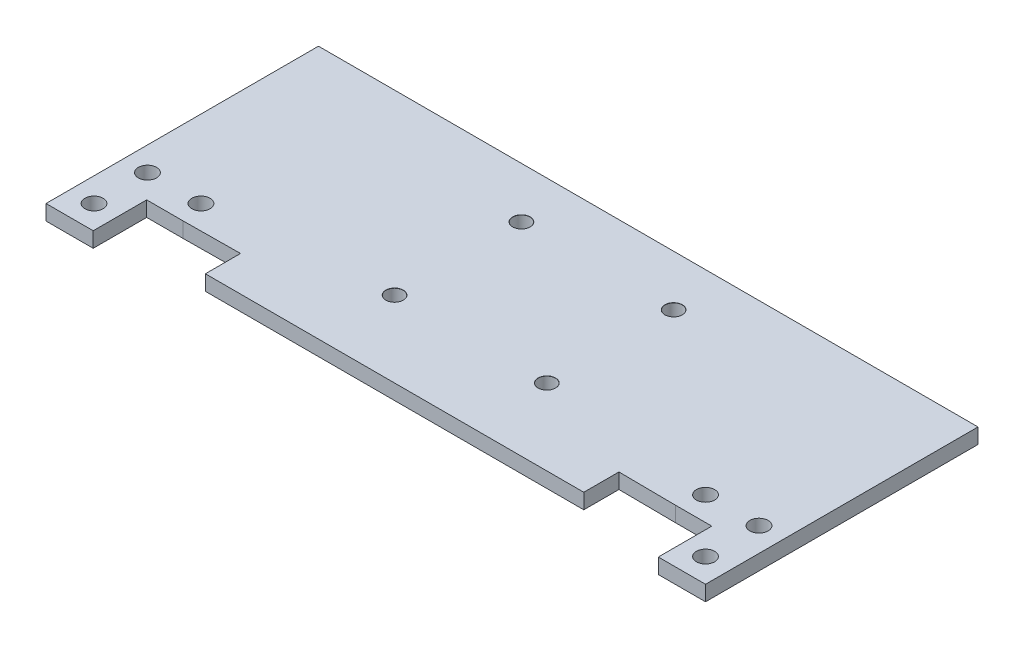
from build123d import *

# Parameters (mm, degrees)
SKETCH1_W                      = 50
SKETCH1_H                      = 3
BOSS_EXTRUDE1_DEPTH            = 130
M3_CLEARANCE_HOLE2_D           = 3.4
M3_CLEARANCE_HOLE2_CSINK_D     = 3.45
M3_CLEARANCE_HOLE2_CSINK_ANGLE = 90
SKETCH7_W                      = 21.804410209
SKETCH7_H                      = 3.710121499
BOSS_EXTRUDE2_DEPTH            = 3
CUT_EXTRUDE1_DEPTH             = 141.690312744
M3_CLEARANCE_HOLE3_D           = 3.6


with BuildPart() as part:
    # Sketch1 → Boss-Extrude1 (new body)
    with BuildSketch(Plane(origin=(0, 0, 0), x_dir=(0, 0, -1), z_dir=(1, 0, 0))):
        with Locations((28.71, 1.5)):
            Rectangle(SKETCH1_W, SKETCH1_H)
    extrude(amount=BOSS_EXTRUDE1_DEPTH)

    # M3 Clearance Hole2 (through all)
    with Locations(Plane(origin=(0, 3, 0), x_dir=(1, 0, 0), z_dir=(0, 1, 0))):
        with Locations((80, 18.71), (50, 43.71), (80, 43.71), (50, 18.71)):
            CounterSinkHole(M3_CLEARANCE_HOLE2_D / 2, M3_CLEARANCE_HOLE2_CSINK_D / 2, counter_sink_angle=M3_CLEARANCE_HOLE2_CSINK_ANGLE)

    # Sketch7 → Boss-Extrude2 (add)
    with BuildSketch(Plane.XZ):
        with Locations((119.097794896, -1.854939251)):
            Rectangle(SKETCH7_W, SKETCH7_H)
        with Locations((10.902205105, -1.854939251)):
            Rectangle(SKETCH7_W, SKETCH7_H)
    extrude(amount=-BOSS_EXTRUDE2_DEPTH)

    # Sketch9 → Cut-Extrude1 (cut, through all)
    # profile 1 of 2: a face of its own
    with BuildSketch(Plane(origin=(0, 3, 0), x_dir=(1, 0, 0), z_dir=(0, 1, 0))):
        Polygon((102.295589791, 0.840390735), (102.295589791, 10.639411436), (113.496480192, 10.53967858), (120.695589791, 10.53967858), (120.695589791, -4.617254568), align=None)
        Polygon((120.495589791, 10.33967858), (113.495589791, 10.33967858), (102.495589791, 10.437622706), (102.495589791, 0.989680888), (120.495589791, -4.349319951), align=None, mode=Mode.SUBTRACT)
    # profile 2 of 2: a face of its own
    with BuildSketch(Plane(origin=(0, 3, 0), x_dir=(1, 0, 0), z_dir=(0, 1, 0))):
        Polygon((9.304410209, 10.53967858), (9.304410209, -4.617254568), (27.704410209, 0.840390735), (27.704410209, 10.639411436), (16.503519826, 10.53967858), align=None)
    extrude(amount=-CUT_EXTRUDE1_DEPTH, mode=Mode.SUBTRACT)


with BuildPart() as cut_extrude1_kept_piece:
    # of the separate pieces the step leaves, the one the design keeps (cut_extrude1_pieces_kept)
    add(part.part.solids().sort_by_distance((27.704410209, 3, -3.71))[0])

    # M3 Clearance Hole3 (through all)
    with Locations(Plane(origin=(0, 3, 0), x_dir=(1, 0, 0), z_dir=(0, 1, 0))):
        with Locations((125.269900039, 4.729978462), (125.269900039, 15.269778541), (114.730099961, 15.269778541)):
            m3_clearance_hole3 = Hole(M3_CLEARANCE_HOLE3_D / 2)

    # Mirror1: M3 Clearance Hole3 across plane
    add(m3_clearance_hole3.mirror(Plane(origin=(65, 0, 0), x_dir=(0, 0, 1), z_dir=(1, 0, 0))), mode=Mode.SUBTRACT)


solid = cut_extrude1_kept_piece.part
